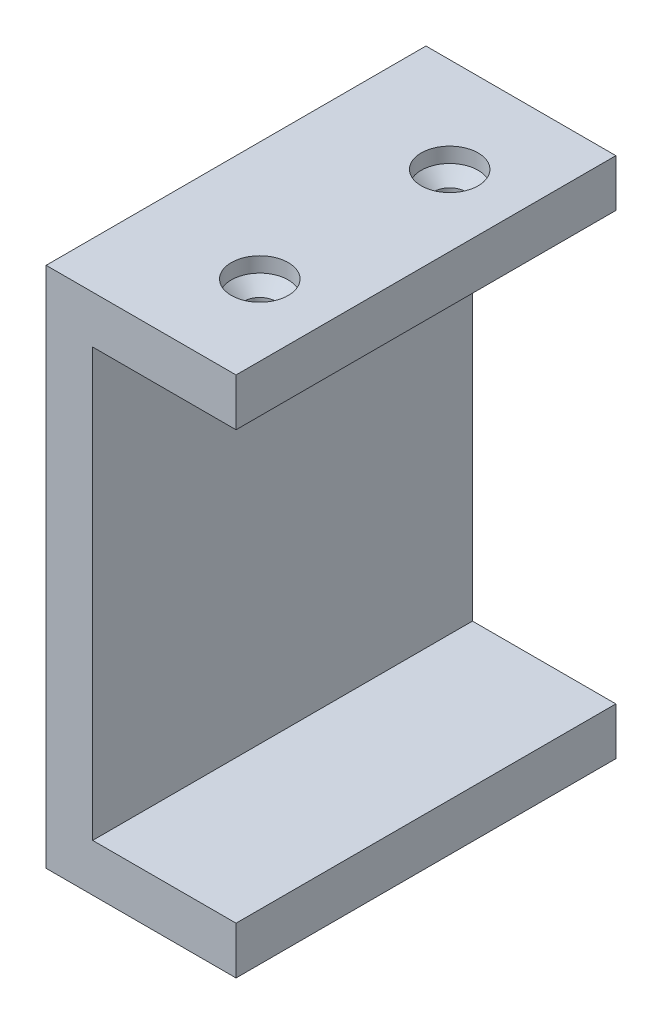
from build123d import *

# Parameters (mm, degrees)
BOSS_EXTRUDE1_DEPTH = 5
SKETCH2_W           = 4.9
SKETCH2_H           = 40
BOSS_EXTRUDE2_DEPTH = 45
SKETCH3_W           = 20
SKETCH3_H           = 40
BOSS_EXTRUDE3_DEPTH = 5
SKETCH4_R           = 3
CUT_EXTRUDE1_DEPTH  = 5


with BuildPart() as part:
    # Sketch1 → Boss-Extrude1 (new body)
    with BuildSketch(Plane(origin=(0, 0, 0), x_dir=(1, 0, 0), z_dir=(0, 1, 0))):
        Polygon((-7.5, -20), (7.5, -20), (7.5, 20), (-7.5, 20), (-12.5, 20), (-12.5, -20), align=None)
    extrude(amount=BOSS_EXTRUDE1_DEPTH)

    # Sketch2 → Boss-Extrude2 (add)
    with BuildSketch(Plane(origin=(0, 0, 0), x_dir=(1, 0, 0), z_dir=(0, 1, 0))):
        with Locations((-10.05, 0)):
            Rectangle(SKETCH2_W, SKETCH2_H)
    extrude(amount=-BOSS_EXTRUDE2_DEPTH)

    # Sketch3 → Boss-Extrude3 (add)
    with BuildSketch(Plane.XZ.offset(45)):
        with Locations((-2.5, 0)):
            Rectangle(SKETCH3_W, SKETCH3_H)
    extrude(amount=BOSS_EXTRUDE3_DEPTH)

    # Sketch4 → Cut-Extrude1 (cut)
    with BuildSketch(Plane.XZ):
        with Locations(Location((0, -10, 0), (0, 0, 270))):
            Circle(SKETCH4_R)
        with Locations(Location((0, 10, 0), (0, 0, 90))):
            Circle(SKETCH4_R)
    extrude(amount=-CUT_EXTRUDE1_DEPTH, mode=Mode.SUBTRACT)

    # Sketch5 → Revolve1 (revolve)
    with BuildSketch(Plane(origin=(0, 0, 0), x_dir=(0, -1, 0), z_dir=(-1, 0, 0))):
        Polygon((-3.415, 13), (-2.115, 11.7), (0, 11.7), (0, 13), align=None)
    revolve1 = revolve(axis=Axis((0, 5, 10), (0, -1, 0)))

    # Mirror1: Revolve1 across plane
    add(revolve1.mirror(Plane.XY))


solid = part.part
